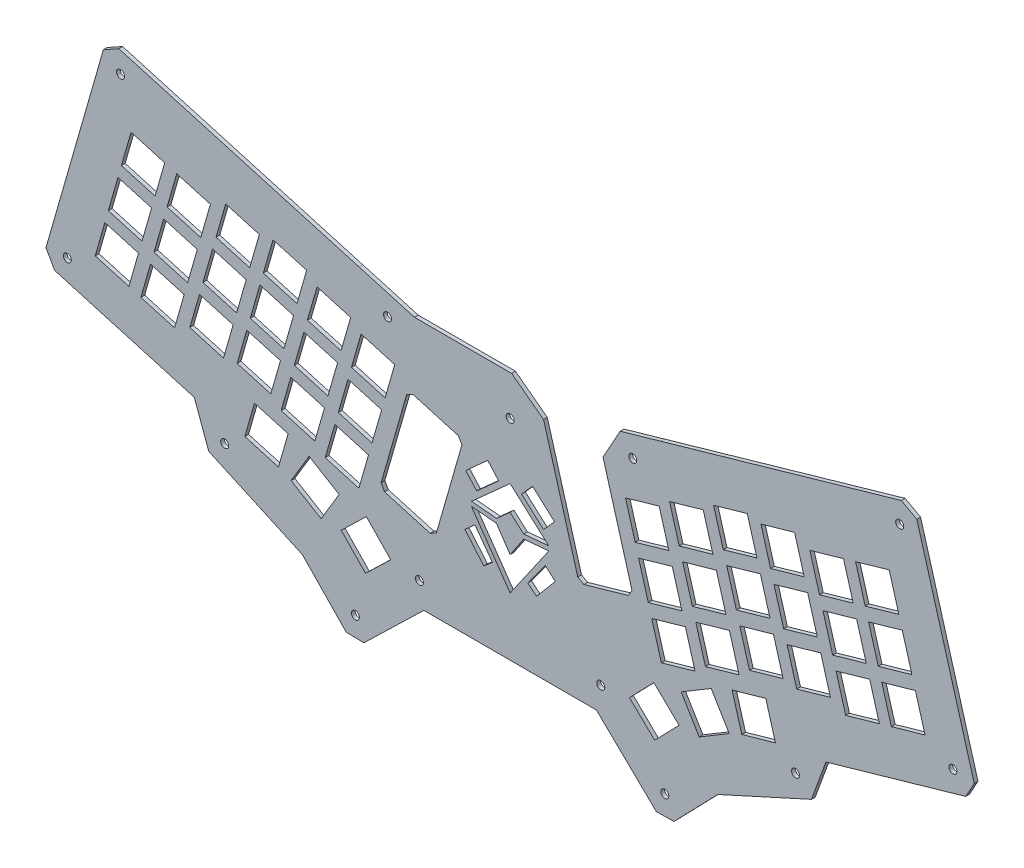
from build123d import *

# Parameters (mm, degrees)
ESQUISSE1_R        = 1.6
BOSS_EXTRU_1_DEPTH = 1.5


with BuildPart() as part:
    # Esquisse1 → Boss.-Extru.1 (new body)
    with BuildSketch(Plane.XY):
        Polygon((-102.267806075, -134.437972545), (-84.723821109, -116.319052626), (-47.296900898, -99.298065073), (-41.491708262, -83.459404935), (14.381168218, -67.438115415), (17.809289919, -61.253620157), (-5.137146777, 18.770114611), (-11.32171868, 22.19850363), (-107.454535032, -5.36135166), (-114.180015808, -7.289852239), (-123.793577085, -10.046496577), (-130.649820486, -22.415487094), (-119.070790786, -62.796362516), (-120.442039466, -65.27016062), (-138.268849115, -70.381916029), (-140.742647218, -69.010667349), (-154.419403971, -21.314148304), (-167.175777529, -11.701531345), (-206.025150502, -11.701531345), (-221.410503936, -7.289852239), (-228.135984711, -5.36135166), (-324.268801063, 22.19850363), (-330.453372966, 18.770114611), (-353.399809662, -61.253620157), (-349.971687961, -67.438115415), (-294.098811481, -83.459404935), (-288.293618845, -99.298065073), (-250.866698634, -116.319052626), (-233.322713669, -134.437972545), (-226.255271496, -134.549159576), (-202.296830677, -111.350948678), (-133.293689066, -111.350948678), (-109.335248247, -134.549159576), align=None)
        with Locations((-12.000450916, 13.68165837)):
            Circle(ESQUISSE1_R, mode=Mode.SUBTRACT)
        with Locations((-118.757933777, -16.924131519)):
            Circle(ESQUISSE1_R, mode=Mode.SUBTRACT)
        with Locations((9.292284284, -60.574933915)):
            Circle(ESQUISSE1_R, mode=Mode.SUBTRACT)
        with Locations((-53.656180266, -93.401689518)):
            Circle(ESQUISSE1_R, mode=Mode.SUBTRACT)
        with Locations((-105.923928137, -126.713325795)):
            Circle(ESQUISSE1_R, mode=Mode.SUBTRACT)
        with Locations((-131.530967037, -101.880200807)):
            Circle(ESQUISSE1_R, mode=Mode.SUBTRACT)
        with Locations(Location((-204.059552706, -101.880200807, 0), (0, 0, 180))):
            Circle(ESQUISSE1_R, mode=Mode.SUBTRACT)
        with Locations(Location((-229.666591606, -126.713325795, 0), (0, 0, 180))):
            Circle(ESQUISSE1_R, mode=Mode.SUBTRACT)
        with Locations(Location((-281.934339477, -93.401689518, 0), (0, 0, 180))):
            Circle(ESQUISSE1_R, mode=Mode.SUBTRACT)
        with Locations(Location((-344.882804027, -60.574933915, 0), (0, 0, 180))):
            Circle(ESQUISSE1_R, mode=Mode.SUBTRACT)
        with Locations(Location((-216.832585966, -16.924131519, 0), (0, 0, 180))):
            Circle(ESQUISSE1_R, mode=Mode.SUBTRACT)
        with Locations(Location((-323.590068827, 13.68165837, 0), (0, 0, 180))):
            Circle(ESQUISSE1_R, mode=Mode.SUBTRACT)
        with Locations(Location((-167.795259872, -27.605548894, 0), (0, 0, 180))):
            Circle(ESQUISSE1_R, mode=Mode.SUBTRACT)
        Polygon((-121.646075908, -32.047544313), (-108.187467847, -28.188350553), (-104.328274087, -41.646958614), (-117.786882148, -45.506152375), align=None, mode=Mode.SUBTRACT)
        Polygon((-100.176299623, -37.98551269), (-104.035493384, -24.526904628), (-90.576885322, -20.667710868), (-86.717691562, -34.126318929), align=None, mode=Mode.SUBTRACT)
        Polygon((-82.565717099, -30.464873005), (-86.424910859, -17.006264943), (-72.966302798, -13.147071183), (-69.107109038, -26.605679244), align=None, mode=Mode.SUBTRACT)
        Polygon((-63.645764268, -27.510550239), (-67.504958028, -14.051942178), (-54.046349967, -10.192748417), (-50.187156207, -23.651356479), align=None, mode=Mode.SUBTRACT)
        Polygon((-44.071126284, -26.839385933), (-47.930320044, -13.380777872), (-34.471711983, -9.521584111), (-30.612518223, -22.980192173), align=None, mode=Mode.SUBTRACT)
        Polygon((-25.805370251, -21.601764674), (-29.664564011, -8.143156613), (-16.20595595, -4.283962852), (-12.346762189, -17.742570914), align=None, mode=Mode.SUBTRACT)
        Polygon((-116.408594683, -50.312811991), (-102.949986622, -46.453618231), (-99.090792861, -59.912226292), (-112.549400923, -63.771420052), align=None, mode=Mode.SUBTRACT)
        Polygon((-98.798012158, -42.792172306), (-85.339404097, -38.932978546), (-81.480210337, -52.391586607), (-94.938818398, -56.250780367), align=None, mode=Mode.SUBTRACT)
        Polygon((-81.187429634, -35.271532621), (-67.728821573, -31.412338861), (-63.869627812, -44.870946922), (-77.328235874, -48.730140682), align=None, mode=Mode.SUBTRACT)
        Polygon((-62.267476803, -32.317209855), (-48.808868742, -28.458016095), (-44.949674981, -41.916624156), (-58.408283043, -45.775817917), align=None, mode=Mode.SUBTRACT)
        Polygon((-42.692838819, -31.646045549), (-29.234230758, -27.786851789), (-25.375036997, -41.24545985), (-38.833645059, -45.104653611), align=None, mode=Mode.SUBTRACT)
        Polygon((-24.427082786, -26.40842429), (-10.968474724, -22.54923053), (-7.109280964, -36.007838591), (-20.567889026, -39.867032352), align=None, mode=Mode.SUBTRACT)
        Polygon((-19.189601561, -44.673691968), (-5.730993499, -40.814498208), (-1.871799739, -54.273106269), (-15.3304078, -58.132300029), align=None, mode=Mode.SUBTRACT)
        Polygon((-37.455357594, -49.911313227), (-23.996749532, -46.052119467), (-20.137555772, -59.510727528), (-33.596163833, -63.369921288), align=None, mode=Mode.SUBTRACT)
        Polygon((-57.029995578, -50.582477533), (-43.571387516, -46.723283773), (-39.712193756, -60.181891834), (-53.170801817, -64.041085594), align=None, mode=Mode.SUBTRACT)
        Polygon((-75.949948409, -53.536800299), (-62.491340347, -49.677606538), (-58.632146587, -63.1362146), (-72.090754648, -66.99540836), align=None, mode=Mode.SUBTRACT)
        Polygon((-93.560530933, -61.057439984), (-80.101922872, -57.198246223), (-76.242729111, -70.656854285), (-89.701337173, -74.516048045), align=None, mode=Mode.SUBTRACT)
        Polygon((-111.171113458, -68.578079669), (-97.712505396, -64.718885908), (-93.853311636, -78.17749397), (-107.311919697, -82.03668773), align=None, mode=Mode.SUBTRACT)
        Polygon((-79.018130302, -77.304798222), (-65.559522241, -73.445604462), (-61.700328481, -86.904212523), (-75.158936542, -90.763406284), align=None, mode=Mode.SUBTRACT)
        Polygon((-99.400078923, -88.135090111), (-87.391574532, -80.936247863), (-80.192732283, -92.944752254), (-92.201236674, -100.143594502), align=None, mode=Mode.SUBTRACT)
        Polygon((-120.049818618, -100.436716825), (-110.317049076, -90.371891716), (-100.252223967, -100.104661258), (-109.984993509, -110.169486367), align=None, mode=Mode.SUBTRACT)
        Polygon((-167.797163962, -50.176578743), (-183.208239782, -64.01395306), (-173.182403601, -64.93571121), (-167.797163962, -60.10038514), (-162.411924322, -64.93571121), (-152.386088141, -64.01395306), align=None, mode=Mode.SUBTRACT)
        Polygon((-183.29869602, -65.767720201), (-173.272859839, -66.689478352), (-167.80522325, -74.788204344), (-162.33758666, -66.689478352), (-152.311750479, -65.767720201), (-167.80522325, -88.078204586), align=None, mode=Mode.SUBTRACT)
        Polygon((-181.841352183, -71.532203558), (-174.868446795, -81.017087284), (-178.354899489, -83.962165336), (-185.878815712, -75.055176278), align=None, mode=Mode.SUBTRACT)
        Polygon((-176.762533711, -46.633239044), (-185.5498232, -54.529064382), (-181.156178455, -59.418765791), (-172.368888966, -51.522940453), align=None, mode=Mode.SUBTRACT)
        Polygon((-225.605526235, -110.169486367), (-215.540701125, -100.436716825), (-225.273470667, -90.371891716), (-235.338295776, -100.104661258), align=None, mode=Mode.SUBTRACT)
        Polygon((-243.389283069, -100.143594502), (-236.19044082, -88.135090111), (-248.198945211, -80.936247863), (-255.39778746, -92.944752254), align=None, mode=Mode.SUBTRACT)
        Polygon((-260.431583201, -90.763406284), (-256.572389441, -77.304798222), (-270.030997502, -73.445604462), (-273.890191262, -86.904212523), align=None, mode=Mode.SUBTRACT)
        Polygon((-228.278600046, -82.03668773), (-224.419406286, -68.578079669), (-237.878014347, -64.718885908), (-241.737208107, -78.17749397), align=None, mode=Mode.SUBTRACT)
        Polygon((-245.88918257, -74.516048045), (-242.02998881, -61.057439984), (-255.488596871, -57.198246223), (-259.347790632, -70.656854285), align=None, mode=Mode.SUBTRACT)
        Polygon((-263.499765095, -66.99540836), (-259.640571335, -53.536800299), (-273.099179396, -49.677606538), (-276.958373156, -63.1362146), align=None, mode=Mode.SUBTRACT)
        Polygon((-282.419717926, -64.041085594), (-278.560524165, -50.582477533), (-292.019132227, -46.723283773), (-295.878325987, -60.181891834), align=None, mode=Mode.SUBTRACT)
        Polygon((-301.99435591, -63.369921288), (-298.135162149, -49.911313227), (-311.593770211, -46.052119467), (-315.452963971, -59.510727528), align=None, mode=Mode.SUBTRACT)
        Polygon((-320.260111943, -58.132300029), (-316.400918183, -44.673691968), (-329.859526244, -40.814498208), (-333.718720004, -54.273106269), align=None, mode=Mode.SUBTRACT)
        Polygon((-315.022630718, -39.867032352), (-311.163436957, -26.40842429), (-324.622045019, -22.54923053), (-328.481238779, -36.007838591), align=None, mode=Mode.SUBTRACT)
        Polygon((-296.756874684, -45.104653611), (-292.897680924, -31.646045549), (-306.356288985, -27.786851789), (-310.215482746, -41.24545985), align=None, mode=Mode.SUBTRACT)
        Polygon((-277.1822367, -45.775817917), (-273.32304294, -32.317209855), (-286.781651001, -28.458016095), (-290.640844762, -41.916624156), align=None, mode=Mode.SUBTRACT)
        Polygon((-258.26228387, -48.730140682), (-254.403090109, -35.271532621), (-267.861698171, -31.412338861), (-271.720891931, -44.870946922), align=None, mode=Mode.SUBTRACT)
        Polygon((-240.651701345, -56.250780367), (-236.792507585, -42.792172306), (-250.251115646, -38.932978546), (-254.110309406, -52.391586607), align=None, mode=Mode.SUBTRACT)
        Polygon((-223.041118821, -63.771420052), (-219.18192506, -50.312811991), (-232.640533122, -46.453618231), (-236.499726882, -59.912226292), align=None, mode=Mode.SUBTRACT)
        Polygon((-323.243757554, -17.742570914), (-309.785149492, -21.601764674), (-305.925955732, -8.143156613), (-319.384563793, -4.283962852), align=None, mode=Mode.SUBTRACT)
        Polygon((-304.97800152, -22.980192173), (-291.519393459, -26.839385933), (-287.660199699, -13.380777872), (-301.11880776, -9.521584111), align=None, mode=Mode.SUBTRACT)
        Polygon((-285.403363536, -23.651356479), (-271.944755475, -27.510550239), (-268.085561715, -14.051942178), (-281.544169776, -10.192748417), align=None, mode=Mode.SUBTRACT)
        Polygon((-266.483410706, -26.605679244), (-253.024802644, -30.464873005), (-249.165608884, -17.006264943), (-262.624216945, -13.147071183), align=None, mode=Mode.SUBTRACT)
        Polygon((-248.872828181, -34.126318929), (-235.41422012, -37.98551269), (-231.555026359, -24.526904628), (-245.013634421, -20.667710868), align=None, mode=Mode.SUBTRACT)
        Polygon((-217.803637595, -45.506152375), (-213.944443835, -32.047544313), (-227.403051896, -28.188350553), (-231.262245657, -41.646958614), align=None, mode=Mode.SUBTRACT)
        Polygon((-163.225438958, -51.522940453), (-158.831794213, -46.633239044), (-150.044504724, -54.529064382), (-154.438149469, -59.418765791), align=None, mode=Mode.SUBTRACT)
        Polygon((-149.731630787, -75.055176278), (-153.769094316, -71.532203558), (-160.741999704, -81.017087284), (-157.25554701, -83.962165336), align=None, mode=Mode.SUBTRACT)
        Polygon((-197.274945207, -82.010279702), (-187.078341197, -46.443029785), (-188.449727462, -43.969307951), (-206.713990933, -38.733214), (-209.187712767, -40.104600265), (-219.384316777, -75.671850182), (-218.012930512, -78.145572016), (-199.748667041, -83.381665967), align=None, mode=Mode.SUBTRACT)
    extrude(amount=BOSS_EXTRU_1_DEPTH)


solid = part.part
